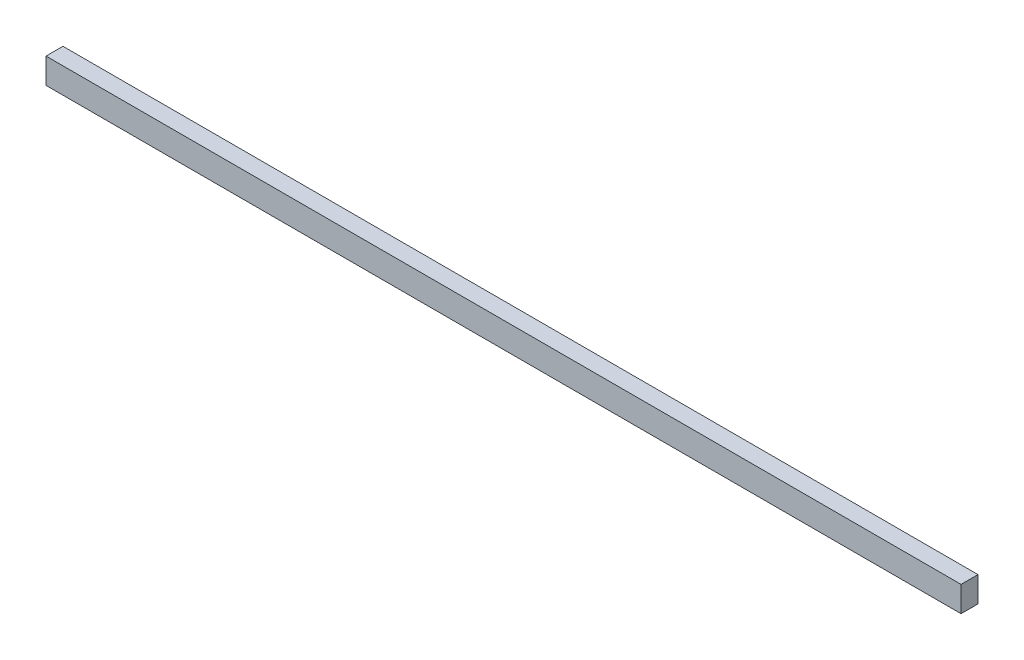
from build123d import *

# Parameters (mm, degrees)
SKETCH_1_W      = 1080
SKETCH_1_H      = 30
EXTRUDE_1_DEPTH = 20


with BuildPart() as part:
    # 草图1 → 凸台-拉伸1 (new body)
    with BuildSketch(Plane.XY):
        Rectangle(SKETCH_1_W, SKETCH_1_H)
    extrude(amount=EXTRUDE_1_DEPTH)


solid = part.part
